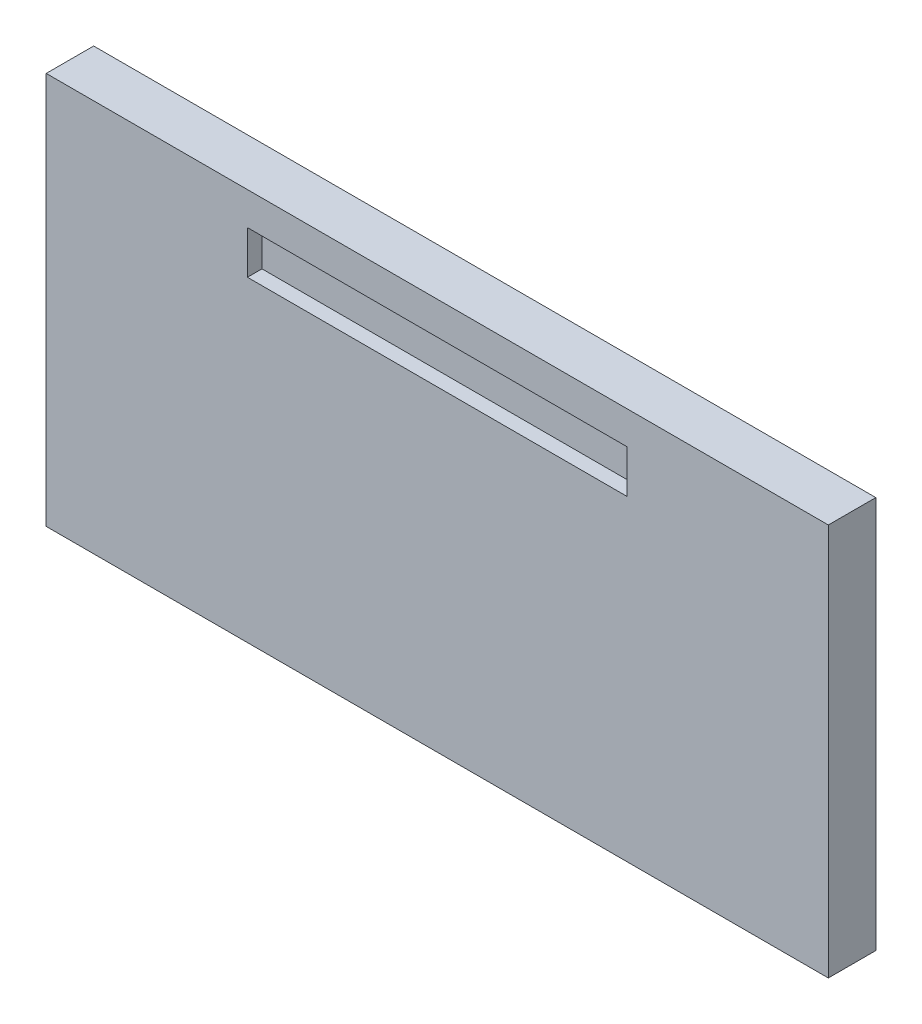
from build123d import *

# Parameters (mm, degrees)
CEK_1L_ON_PU_37_5_1_START = 1
SKETCH1_W                 = 618
SKETCH1_H                 = 310
CEK_1L_ON_PU_37_5_1_DEPTH = 37.5
CEK_1L_ON_PU_37_5_2_START = 27
SKETCH2_W                 = 300
SKETCH2_H                 = 34
CEK_1L_ON_PU_37_5_2_DEPTH = 14


with BuildPart() as part:
    # Sketch1 → CEK_1L_on_pu_37.5_1 (new body)
    with BuildSketch(Plane.XY.offset(CEK_1L_ON_PU_37_5_1_START)):
        with Locations((309, 155)):
            Rectangle(SKETCH1_W, SKETCH1_H)
    extrude(amount=CEK_1L_ON_PU_37_5_1_DEPTH)

    # Sketch2 → CEK_1L_on_pu_37.5_2 (cut)
    with BuildSketch(Plane.XY.offset(CEK_1L_ON_PU_37_5_2_START)):
        with Locations((309, 267)):
            Rectangle(SKETCH2_W, SKETCH2_H)
    extrude(amount=CEK_1L_ON_PU_37_5_2_DEPTH, mode=Mode.SUBTRACT)


solid = part.part
